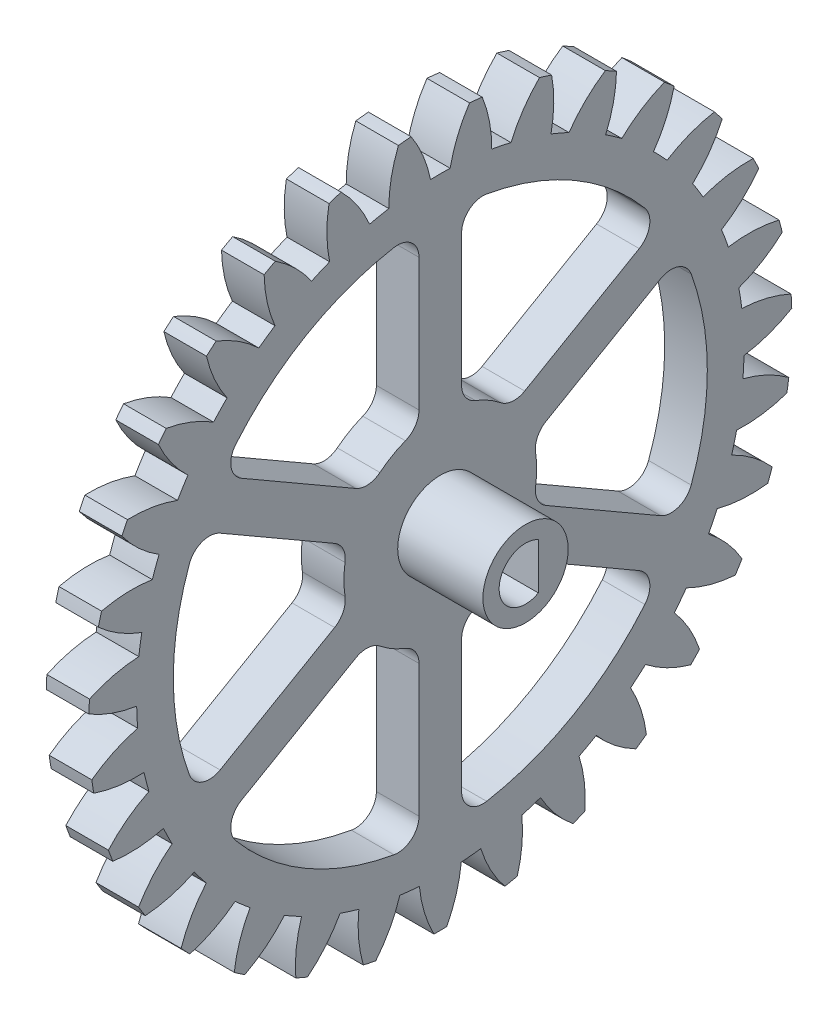
from build123d import *

# Parameters (mm, degrees)
BASPROSKE_W         = 6.35
BASPROSKE_H         = 52.3875
TOOTHCUT_DEPTH      = 75.358744022
TEETHCUTS_COUNT     = 31
TEETHCUTS_ANGLE     = 348.387096774
BORSKE_R            = 1.5875
BORE_DEPTH          = 50.8000508
SKETCH1_R           = 6.35
BOSS_EXTRUDE1_DEPTH = 12.7
CUT_EXTRUDE1_DEPTH  = 77.47803774
CUT_EXTRUDE2_DEPTH  = 76.148371616
FILLET1_R           = 3.175


with BuildPart() as part:
    # BasProSke → Base-Revolve (revolve)
    with BuildSketch(Plane(origin=(0, 0, 0), x_dir=(1, 0, 0), z_dir=(0, 1, 0)), mode=Mode.PRIVATE) as base_revolve_sk:
        with Locations((3.175, 26.19375)):
            Rectangle(BASPROSKE_W, BASPROSKE_H)
    revolve(base_revolve_sk.sketch.rotate(Axis((-10, 0, 0), (1, 0, 0)), 180), axis=Axis((-10, 0, 0), (1, 0, 0)))

    # TooCutSke → ToothCut (cut, through all)
    with BuildSketch(Plane(origin=(0, 0, 0), x_dir=(0, 0, -1), z_dir=(1, 0, 0))):
        with BuildLine():
            ThreePointArc((1.463849368, 45.218791908), (0, 45.24248), (-1.463849368, 45.218791908))
            ThreePointArc((-1.463849368, 45.218791908), (-2.576989882, 48.866022486), (-4.37245228, 52.230199573))
            ThreePointArc((-4.37245228, 52.230199573), (0, 52.4129), (4.37245228, 52.230199573))
            ThreePointArc((4.37245228, 52.230199573), (2.576989882, 48.866022486), (1.463849368, 45.218791908))
        make_face()
    toothcut = extrude(amount=TOOTHCUT_DEPTH, mode=Mode.SUBTRACT)

    # TeethCuts: ToothCut ×31 about axis
    teethcuts_axis = Axis((-10, 0, 0), (1, 0, 0))
    for i in range(1, TEETHCUTS_COUNT):
        add(toothcut.rotate(teethcuts_axis, i * TEETHCUTS_ANGLE / (TEETHCUTS_COUNT - 1)), mode=Mode.SUBTRACT)

    # BorSke → Bore (cut, symmetric)
    with BuildSketch(Plane(origin=(0, 0, 0), x_dir=(0, 0, -1), z_dir=(1, 0, 0))):
        with Locations(Location((0, 0, 0), (0, 0, 180))):
            Circle(BORSKE_R)
    extrude(amount=BORE_DEPTH, both=True, mode=Mode.SUBTRACT)

    # Sketch1 → Boss-Extrude1 (add)
    with BuildSketch(Plane(origin=(6.35, 0, 0), x_dir=(0, 0, -1), z_dir=(1, 0, 0))):
        with Locations(Location((0, 0, 0), (0, 0, 180))):
            Circle(SKETCH1_R)
    extrude(amount=BOSS_EXTRUDE1_DEPTH)

    # Sketch2 → Cut-Extrude1 (cut, through all)
    with BuildSketch(Plane(origin=(19.05, 0, 0), x_dir=(0, 0, -1), z_dir=(1, 0, 0))):
        with BuildLine():
            ThreePointArc((1.905, 3.445423631), (-3.937, 0), (1.905, -3.445423631))
            Line((1.905, -3.445423631), (1.905, 3.445423631))
        make_face()
    extrude(amount=-CUT_EXTRUDE1_DEPTH, mode=Mode.SUBTRACT)

    # Sketch3 → Cut-Extrude2 (cut, through all)
    with BuildSketch(Plane(origin=(6.35, 0, 0), x_dir=(0, 0, -1), z_dir=(1, 0, 0))):
        with BuildLine():
            ThreePointArc((-3.175, 39.654095758), (-19.890499839, 34.451356309), (-32.753954291, 22.576678536))
            Line((-32.753954291, 22.576678536), (-10.547160301, 9.755580049))
            ThreePointArc((-10.547160301, 9.755580049), (-7.18355644, 12.442284733), (-3.175, 14.011898783))
            Line((-3.175, 14.011898783), (-3.175, 39.654095758))
        make_face()
        with BuildLine():
            Line((-13.722160301, 4.256318734), (-35.928954291, 17.077417222))
            ThreePointArc((-35.928954291, 17.077417222), (-39.780999678, 0), (-35.928954291, -17.077417222))
            Line((-35.928954291, -17.077417222), (-13.722160301, -4.256318734))
            ThreePointArc((-13.722160301, -4.256318734), (-14.36711288, 0), (-13.722160301, 4.256318734))
        make_face()
        with BuildLine():
            Line((-10.547160301, -9.755580049), (-32.753954291, -22.576678536))
            ThreePointArc((-32.753954291, -22.576678536), (-19.890499839, -34.451356309), (-3.175, -39.654095758))
            Line((-3.175, -39.654095758), (-3.175, -14.011898783))
            ThreePointArc((-3.175, -14.011898783), (-7.18355644, -12.442284733), (-10.547160301, -9.755580049))
        make_face()
        with BuildLine():
            Line((3.175, -14.011898783), (3.175, -39.654095758))
            ThreePointArc((3.175, -39.654095758), (19.890499839, -34.451356309), (32.753954291, -22.576678536))
            Line((32.753954291, -22.576678536), (10.547160301, -9.755580049))
            ThreePointArc((10.547160301, -9.755580049), (7.18355644, -12.442284733), (3.175, -14.011898783))
        make_face()
        with BuildLine():
            ThreePointArc((39.780999678, 0), (38.806041118, 8.753234154), (35.928954291, 17.077417222))
            Line((35.928954291, 17.077417222), (13.722160301, 4.256318734))
            ThreePointArc((13.722160301, 4.256318734), (14.204959671, 2.152452845), (14.36711288, 0))
            ThreePointArc((14.36711288, 0), (14.204959671, -2.152452845), (13.722160301, -4.256318734))
            Line((13.722160301, -4.256318734), (35.928954291, -17.077417222))
            ThreePointArc((35.928954291, -17.077417222), (38.806041118, -8.753234154), (39.780999678, 0))
        make_face()
        with BuildLine():
            ThreePointArc((32.753954291, 22.576678536), (19.890499839, 34.451356309), (3.175, 39.654095758))
            Line((3.175, 39.654095758), (3.175, 14.011898783))
            ThreePointArc((3.175, 14.011898783), (7.18355644, 12.442284733), (10.547160301, 9.755580049))
            Line((10.547160301, 9.755580049), (32.753954291, 22.576678536))
        make_face()
    extrude(amount=-CUT_EXTRUDE2_DEPTH, mode=Mode.SUBTRACT)

    # Fillet1
    fillet1_edges = [part.edges().sort_by_distance(p)[0] for p in [
        (3.175, -9.755580049, 10.547160301),
        (3.175, -14.011898783, 3.175),
        (3.175, -39.654095758, 3.175),
        (3.175, -22.576678536, 32.753954291),
        (3.175, 4.256318734, 13.722160301),
        (3.175, -4.256318734, 13.722160301),
        (3.175, -17.077417222, 35.928954291),
        (3.175, 17.077417222, 35.928954291),
        (3.175, -4.256318734, -13.722160301),
        (3.175, 4.256318734, -13.722160301),
        (3.175, 17.077417222, -35.928954291),
        (3.175, -17.077417222, -35.928954291),
        (3.175, -14.011898783, -3.175),
        (3.175, -9.755580049, -10.547160301),
        (3.175, -22.576678536, -32.753954291),
        (3.175, -39.654095758, -3.175),
        (3.175, 9.755580049, -10.547160301),
        (3.175, 14.011898783, -3.175),
        (3.175, 39.654095758, -3.175),
        (3.175, 22.576678536, -32.753954291),
        (3.175, 14.011898783, 3.175),
        (3.175, 9.755580049, 10.547160301),
        (3.175, 22.576678536, 32.753954291),
        (3.175, 39.654095758, 3.175),
    ]]
    fillet(fillet1_edges, radius=FILLET1_R)


solid = part.part
